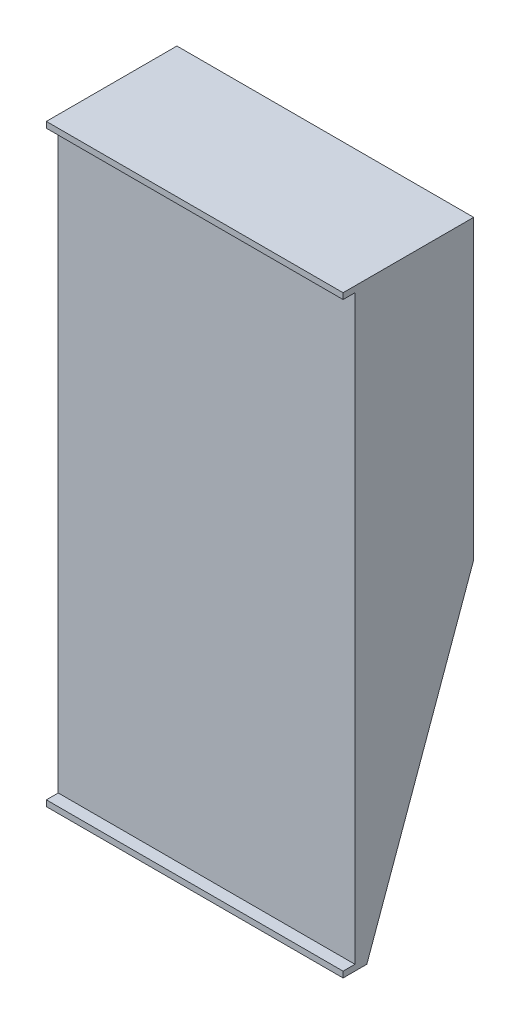
from build123d import *

# Parameters (mm, degrees)
SKETCH1_W           = 6.35
SKETCH1_H           = 12.7
BOSS_EXTRUDE1_DEPTH = 2.54
SKETCH2_W           = 6.35
SKETCH2_H           = 0.127
BOSS_EXTRUDE2_DEPTH = 0.254
CUT_EXTRUDE1_DEPTH  = 10.404862359


with BuildPart() as part:
    # Sketch1 → Boss-Extrude1 (new body)
    with BuildSketch(Plane.XY):
        Rectangle(SKETCH1_W, SKETCH1_H)
    extrude(amount=BOSS_EXTRUDE1_DEPTH)

    # Sketch2 → Boss-Extrude2 (add)
    with BuildSketch(Plane.XY.offset(2.54)):
        with Locations((0, -6.2865)):
            Rectangle(SKETCH2_W, SKETCH2_H)
    boss_extrude2 = extrude(amount=BOSS_EXTRUDE2_DEPTH)

    # Mirror1: Boss-Extrude2 across plane
    add(boss_extrude2.mirror(Plane.ZX))

    # Sketch3 → Cut-Extrude1 (cut, through all)
    with BuildSketch(Plane(origin=(3.175, 0, 0), x_dir=(0, 0, -1), z_dir=(1, 0, 0))):
        Polygon((0, -6.35), (-2.286, -6.35), (0, 0), align=None)
    extrude(amount=-CUT_EXTRUDE1_DEPTH, mode=Mode.SUBTRACT)


solid = part.part
